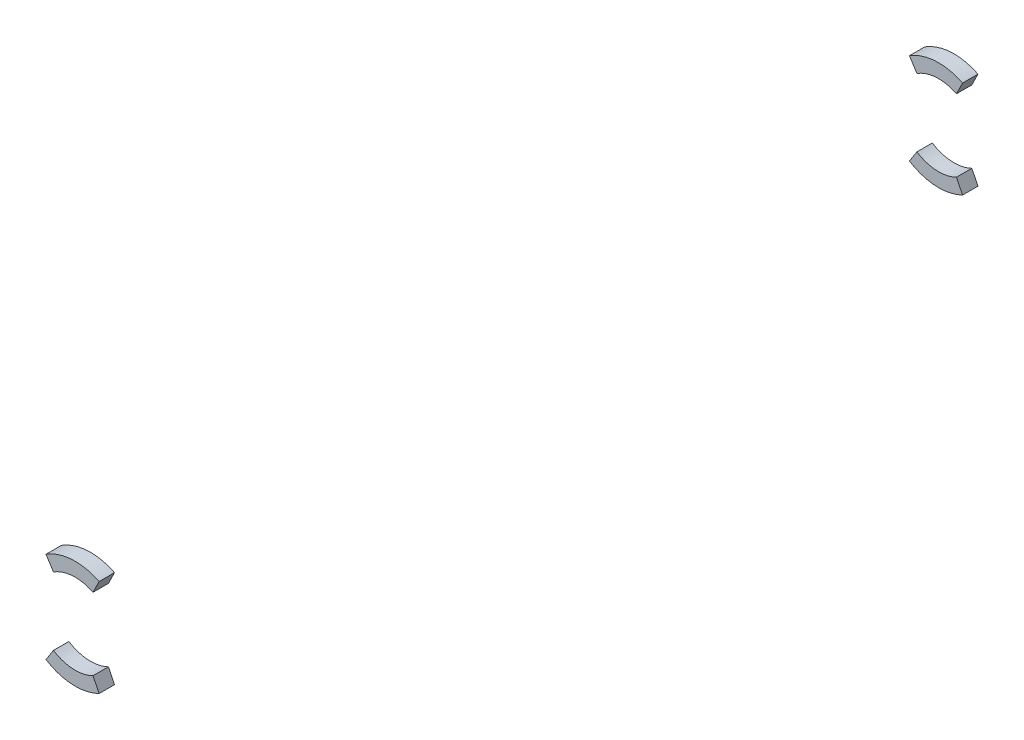
from build123d import *

# Parameters (mm, degrees)
BOSS_EXTRUDE2_DEPTH   = 20
BOSS_EXTRUDE2_2_DEPTH = 20
LPATTERN1_COUNT       = 2
LPATTERN1_PITCH       = 1120


with BuildPart() as part:
    # Sketch2 → Boss-Extrude2 (new body)
    with BuildSketch(Plane.XY):
        with BuildLine():
            Line((-37.821455886, 59.139003749), (-28.160126305, 44.032197495))
            ThreePointArc((-28.160126305, 44.032197495), (-2.870393775, 52.188005991), (23.161241474, 46.854925281))
            Line((23.161241474, 46.854925281), (31.107526408, 62.930168366))
            ThreePointArc((31.107526408, 62.930168366), (-3.855184113, 70.092951467), (-37.821455886, 59.139003749))
        make_face()
    boss_extrude2 = extrude(amount=-BOSS_EXTRUDE2_DEPTH)


with BuildPart() as body_2:
    # Sketch2 → Boss-Extrude2 2 (new body)
    with BuildSketch(Plane.XY):
        with BuildLine():
            Line((31.107526408, -62.930168366), (23.161241474, -46.854925281))
            ThreePointArc((23.161241474, -46.854925281), (-2.870393775, -52.188005991), (-28.160126305, -44.032197495))
            Line((-28.160126305, -44.032197495), (-37.821455886, -59.139003749))
            ThreePointArc((-37.821455886, -59.139003749), (-3.855184113, -70.092951467), (31.107526408, -62.930168366))
        make_face()
    boss_extrude2_2 = extrude(amount=-BOSS_EXTRUDE2_2_DEPTH)


with BuildPart() as lpattern1_1:
    # LPattern1: Boss-Extrude2, Boss-Extrude2 2 ×2
    with Locations(*[(0, 0, i * LPATTERN1_PITCH) for i in range(1, LPATTERN1_COUNT)]):
        add(boss_extrude2)
        add(boss_extrude2_2)


solid = Compound([part.part, body_2.part, lpattern1_1.part])
